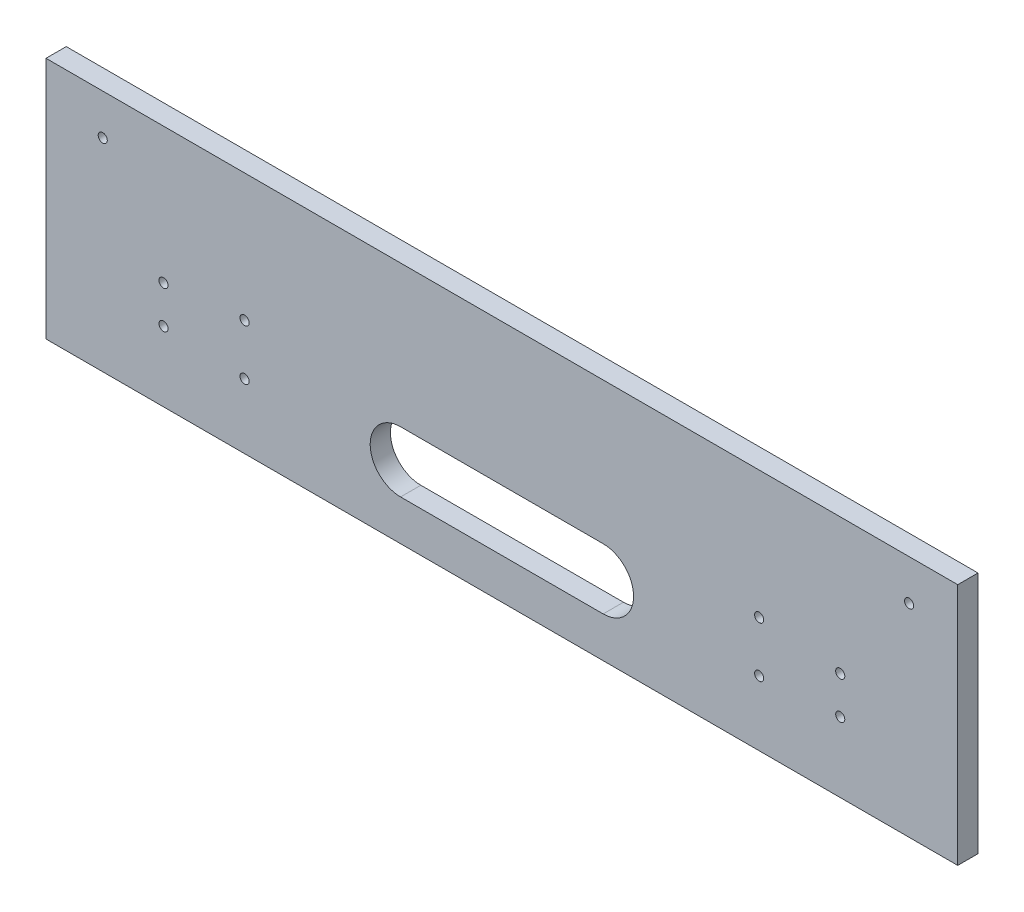
from build123d import *

# Parameters (mm, degrees)
SCHIZZO1_W                   = 450
SCHIZZO1_H                   = 120
ESTRUSIONE_ESTRUSIONE1_DEPTH = 10
TAGLIO_ESTRUSIONE1_DEPTH     = 10
SCHIZZO3_R                   = 2.25
TAGLIO_ESTRUSIONE2_DEPTH     = 10
SCHIZZO4_R                   = 2.25
TAGLIO_ESTRUSIONE3_DEPTH     = 10


with BuildPart() as part:
    # Schizzo1 → Estrusione-Estrusione1 (new body)
    with BuildSketch(Plane.XY):
        Rectangle(SCHIZZO1_W, SCHIZZO1_H)
    extrude(amount=ESTRUSIONE_ESTRUSIONE1_DEPTH)

    # Schizzo2 → Taglio-Estrusione1 (cut)
    with BuildSketch(Plane.XY.offset(10)):
        with BuildLine():
            Line((-50, -10), (50, -10))
            ThreePointArc((50, -10), (65, -25), (50, -40))
            Line((50, -40), (-50, -40))
            ThreePointArc((-50, -40), (-65, -25), (-50, -10))
        make_face()
    extrude(amount=-TAGLIO_ESTRUSIONE1_DEPTH, mode=Mode.SUBTRACT)

    # Schizzo3 → Taglio-Estrusione2 (cut)
    with BuildSketch(Plane(origin=(0, 0, 0), x_dir=(-1, 0, 0), z_dir=(0, 0, -1))):
        with Locations((-167, -7)):
            Circle(SCHIZZO3_R)
        with Locations((-167, -25.5)):
            Circle(SCHIZZO3_R)
        with Locations((167, -7)):
            Circle(SCHIZZO3_R)
        with Locations((167, -25.5)):
            Circle(SCHIZZO3_R)
        with Locations((197, 40)):
            Circle(SCHIZZO3_R)
        with Locations((-201, 40)):
            Circle(SCHIZZO3_R)
    extrude(amount=-TAGLIO_ESTRUSIONE2_DEPTH, mode=Mode.SUBTRACT)

    # Schizzo4 → Taglio-Estrusione3 (cut)
    with BuildSketch(Plane.XY.offset(10)):
        with Locations((-127, -3)):
            Circle(SCHIZZO4_R)
        with Locations((-127, -28)):
            Circle(SCHIZZO4_R)
        with Locations((127, -28)):
            Circle(SCHIZZO4_R)
        with Locations((127, -3)):
            Circle(SCHIZZO4_R)
    extrude(amount=-TAGLIO_ESTRUSIONE3_DEPTH, mode=Mode.SUBTRACT)


solid = part.part
